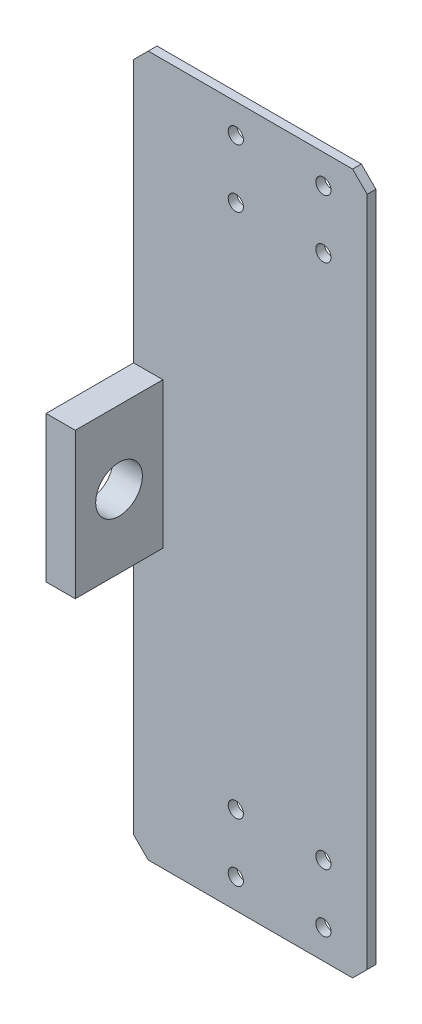
from build123d import *

# Parameters (mm, degrees)
SKETCH_1_R          = 3
SKETCH_1_W          = 90
SKETCH_1_H          = 120
SKETCH_1_R_2        = 10
SKETCH_1_R_3        = 7.5
EXTRUDE_2_DEPTH     = 3
EXTRUDE_START       = -3
SKETCH_2_R          = 10
SKETCH_2_R_2        = 7.5
EXTRUDE_3_DEPTH     = 3
CUT_EXTRUDE_START   = -3
SKETCH_3_R          = 3
SKETCH_3_W          = 90
SKETCH_3_H          = 120
CUT_EXTRUDE_2_DEPTH = 3
SKETCH_4_W          = 10
SKETCH_4_H          = 50
EXTRUDE_4_DEPTH     = 30
SKETCH_5_R          = 8
CUT_EXTRUDE_3_DEPTH = 30
SKETCH_6_R          = 2.6
CUT_EXTRUDE_5_DEPTH = 10


with BuildPart() as part:
    # 草图1 → 凸台-拉伸2 (new body)
    # profile 1 of 9: a face of its own
    with BuildSketch(Plane.XY):
        Polygon((195, -115), (195, 115), (190, 115), (190, 120), (115, 120), (115, 75), (75, 75), (-90, 75), (-130, 75), (-130, 120), (-175, 120), (-175, 90), (-195, 90), (-195, -90), (-175, -90), (-175, -120), (-130, -120), (-130, -75), (-90, -75), (75, -75), (115, -75), (115, -120), (190, -120), (190, -115), align=None)
        with Locations((-184.089468205, -70)):
            Circle(SKETCH_1_R, mode=Mode.SUBTRACT)
        with Locations((-87, -69)):
            Circle(SKETCH_1_R, mode=Mode.SUBTRACT)
        with Locations((-184.089468205, 70)):
            Circle(SKETCH_1_R, mode=Mode.SUBTRACT)
        with Locations((-87, 69)):
            Circle(SKETCH_1_R, mode=Mode.SUBTRACT)
        Rectangle(SKETCH_1_W, SKETCH_1_H, mode=Mode.SUBTRACT)
        with Locations((75, 0)):
            Circle(SKETCH_1_R_2, mode=Mode.SUBTRACT)
        with Locations((117.5, 0)):
            Circle(SKETCH_1_R_3, mode=Mode.SUBTRACT)
    # profile 2 of 9: a face of its own
    with BuildSketch(Plane.XY):
        Polygon((-130, 120), (-90, 75), (-130, 75), align=None)
    # profile 3 of 9: a face of its own
    with BuildSketch(Plane.XY):
        Polygon((-175, 120), (-175, 90), (-195, 90), align=None)
    # profile 4 of 9: a face of its own
    with BuildSketch(Plane.XY):
        Polygon((-175, -120), (-195, -90), (-175, -90), align=None)
    # profile 5 of 9: a face of its own
    with BuildSketch(Plane.XY):
        Polygon((-130, -120), (-130, -75), (-90, -75), align=None)
    # profile 6 of 9: a face of its own
    with BuildSketch(Plane.XY):
        Polygon((115, -120), (75, -75), (115, -75), align=None)
        with Locations((104.379549532, -93)):
            Circle(SKETCH_1_R, mode=Mode.SUBTRACT)
    # profile 7 of 9: a face of its own
    with BuildSketch(Plane.XY):
        Polygon((115, 120), (115, 75), (75, 75), align=None)
        with Locations((104.379549532, 93)):
            Circle(SKETCH_1_R, mode=Mode.SUBTRACT)
    # profile 8 of 9: a face of its own
    with BuildSketch(Plane.XY):
        Polygon((190, 120), (195, 115), (190, 115), align=None)
    # profile 9 of 9: a face of its own
    with BuildSketch(Plane.XY):
        Polygon((190, -115), (190, -120), (195, -115), align=None)
    extrude(amount=EXTRUDE_2_DEPTH)

    # 草图2 → 凸台-拉伸3 (add)
    with BuildSketch(Plane.XY.offset(3).offset(EXTRUDE_START)):
        with Locations((75, 0)):
            Circle(SKETCH_2_R)
        with Locations((117.5, 0)):
            Circle(SKETCH_2_R_2)
    extrude(amount=EXTRUDE_3_DEPTH)

    # 草图3 → 切除-拉伸2 (cut)
    # profile 1 of 3: a face of its own
    with BuildSketch(Plane.XY.offset(3).offset(CUT_EXTRUDE_START)):
        Polygon((115, 120), (115, -120), (75, -75), (-90, -75), (-130, -120), (-175, -120), (-195, -90), (-195, 90), (-175, 120), (-130, 120), (-90, 75), (75, 75), align=None)
        with Locations((-184.089468205, -70)):
            Circle(SKETCH_3_R, mode=Mode.SUBTRACT)
        with Locations((-87, 69)):
            Circle(SKETCH_3_R, mode=Mode.SUBTRACT)
        with Locations((104.379549532, 93)):
            Circle(SKETCH_3_R, mode=Mode.SUBTRACT)
        with Locations((104.379549532, -93)):
            Circle(SKETCH_3_R, mode=Mode.SUBTRACT)
        with Locations((-87, -69)):
            Circle(SKETCH_3_R, mode=Mode.SUBTRACT)
        with Locations((-184.089468205, 70)):
            Circle(SKETCH_3_R, mode=Mode.SUBTRACT)
        Rectangle(SKETCH_3_W, SKETCH_3_H, mode=Mode.SUBTRACT)
    # profile 2 of 3: a face of its own
    with BuildSketch(Plane.XY.offset(3).offset(CUT_EXTRUDE_START)):
        Polygon((120, -120), (115, -115), (115, -120), align=None)
    # profile 3 of 3: a face of its own
    with BuildSketch(Plane.XY.offset(3).offset(CUT_EXTRUDE_START)):
        Polygon((120, 120), (115, 120), (115, 115), align=None)
    extrude(amount=CUT_EXTRUDE_2_DEPTH, mode=Mode.SUBTRACT)

    # 草图4 → 凸台-拉伸4 (add)
    with BuildSketch(Plane.XY.offset(3)):
        with Locations((120, 0)):
            Rectangle(SKETCH_4_W, SKETCH_4_H)
    extrude(amount=EXTRUDE_4_DEPTH)

    # 草图5 → 切除-拉伸3 (cut)
    with BuildSketch(Plane.ZY.offset(-115)):
        with Locations(Location((18, 0, 0), (0, 0, 270))):
            Circle(SKETCH_5_R)
    extrude(amount=-CUT_EXTRUDE_3_DEPTH, mode=Mode.SUBTRACT)

    # 草图6 → 切除-拉伸5 (cut)
    with BuildSketch(Plane.XY.offset(3)):
        with Locations((150, 90)):
            Circle(SKETCH_6_R)
        with Locations((180, 90)):
            Circle(SKETCH_6_R)
        with Locations((180, 110)):
            Circle(SKETCH_6_R)
        with Locations((150, 110)):
            Circle(SKETCH_6_R)
        with Locations((150, -90)):
            Circle(SKETCH_6_R)
        with Locations((150, -110)):
            Circle(SKETCH_6_R)
        with Locations((180, -110)):
            Circle(SKETCH_6_R)
        with Locations((180, -90)):
            Circle(SKETCH_6_R)
    extrude(amount=-CUT_EXTRUDE_5_DEPTH, mode=Mode.SUBTRACT)


solid = part.part
